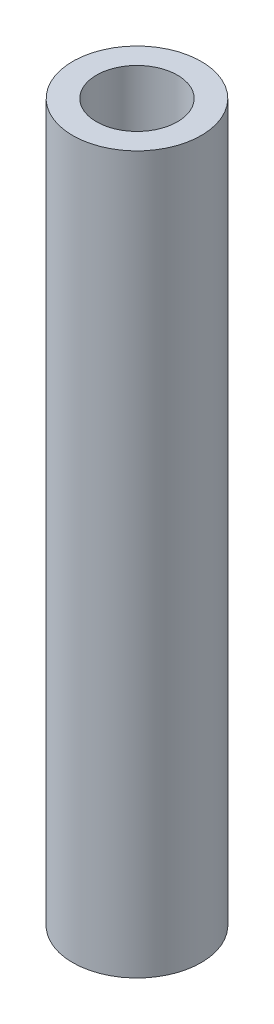
from build123d import *

# Parameters (mm, degrees)
SKETCH1_R           = 3.175
SKETCH1_R_2         = 2
BOSS_EXTRUDE1_DEPTH = 17.7


with BuildPart() as part:
    # Sketch1 → Boss-Extrude1 (new, symmetric)
    with BuildSketch(Plane(origin=(0, 0, 0), x_dir=(1, 0, 0), z_dir=(0, 1, 0))):
        with Locations(Location((0, 0, 0), (0, 0, 270))):
            Circle(SKETCH1_R)
        with Locations(Location((0, 0, 0), (0, 0, 270))):
            Circle(SKETCH1_R_2, mode=Mode.SUBTRACT)
    extrude(amount=BOSS_EXTRUDE1_DEPTH, both=True)


solid = part.part
